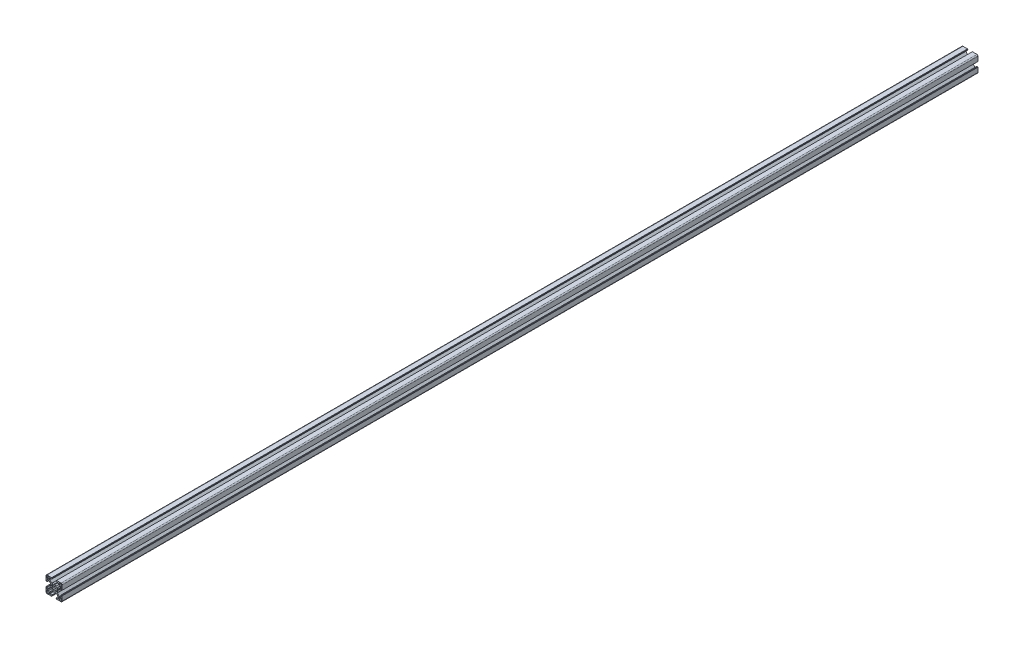
from build123d import *

# Parameters (mm, degrees)
BOSS_EXTRUDE1_DEPTH = 850
CIRPATTERN1_COUNT   = 4


with BuildPart() as part:
    # Sketch3 → Boss-Extrude1 (new, symmetric)
    with BuildSketch(Plane.XY):
        with BuildLine():
            Line((-4.503841895, 3.156803476), (-3.14772708, 1.530298739))
            ThreePointArc((-3.14772708, 1.530298739), (-3.410794979, 0.785160882), (-3.5, 0))
            Line((-3.5, 0), (-5.5, 0))
            Line((-5.5, 0), (-6, 0.866025404))
            Line((-6, 0.866025404), (-6, 3.996841995))
            ThreePointArc((-6, 3.996841995), (-6.038060234, 4.188183711), (-6.146446609, 4.350395385))
            Line((-6.146446609, 4.350395385), (-9.917104615, 8.121053391))
            ThreePointArc((-9.917104615, 8.121053391), (-10.079316289, 8.229439766), (-10.270658005, 8.2675))
            Line((-10.270658005, 8.2675), (-12.29, 8.2675))
            ThreePointArc((-12.29, 8.2675), (-12.643553391, 8.121053391), (-12.79, 7.7675))
            Line((-12.79, 7.7675), (-12.79, 4.5))
            ThreePointArc((-12.79, 4.5), (-12.936446609, 4.146446609), (-13.29, 4))
            Line((-13.29, 4), (-14.5, 4))
            Line((-14.5, 4), (-14.5, 4.5))
            Line((-14.5, 4.5), (-15, 4.5))
            Line((-15, 4.5), (-15, 12.968))
            ThreePointArc((-15, 12.968), (-14.404840979, 14.404840979), (-12.968, 15))
            Line((-12.968, 15), (-4.5, 15))
            Line((-4.5, 15), (-4.5, 14.5))
            Line((-4.5, 14.5), (-4, 14.5))
            Line((-4, 14.5), (-4, 13.29))
            ThreePointArc((-4, 13.29), (-4.146446609, 12.936446609), (-4.5, 12.79))
            Line((-4.5, 12.79), (-7.7675, 12.79))
            ThreePointArc((-7.7675, 12.79), (-8.121053391, 12.643553391), (-8.2675, 12.29))
            Line((-8.2675, 12.29), (-8.2675, 10.270658005))
            ThreePointArc((-8.2675, 10.270658005), (-8.229439766, 10.079316289), (-8.121053391, 9.917104615))
            Line((-8.121053391, 9.917104615), (-4.350395385, 6.146446609))
            ThreePointArc((-4.350395385, 6.146446609), (-4.188183711, 6.038060234), (-3.996841995, 6))
            Line((-3.996841995, 6), (-0.866025404, 6))
            Line((-0.866025404, 6), (0, 5.5))
            Line((0, 5.5), (0, 3.5))
            ThreePointArc((0, 3.5), (-0.785160882, 3.410794979), (-1.530298739, 3.14772708))
            Line((-1.530298739, 3.14772708), (-3.156803476, 4.503841895))
            ThreePointArc((-3.156803476, 4.503841895), (-3.889087297, 3.889087297), (-4.503841895, 3.156803476))
        make_face()
        with BuildLine():
            Line((-12.705, 9.5135), (-10.5135, 9.5135))
            ThreePointArc((-10.5135, 9.5135), (-9.806393219, 9.806393219), (-9.5135, 10.5135))
            Line((-9.5135, 10.5135), (-9.5135, 12.705))
            ThreePointArc((-9.5135, 12.705), (-9.806393219, 13.412106781), (-10.5135, 13.705))
            Line((-10.5135, 13.705), (-12.705, 13.705))
            ThreePointArc((-12.705, 13.705), (-13.412106781, 13.412106781), (-13.705, 12.705))
            Line((-13.705, 12.705), (-13.705, 10.5135))
            ThreePointArc((-13.705, 10.5135), (-13.412106781, 9.806393219), (-12.705, 9.5135))
        make_face(mode=Mode.SUBTRACT)
    boss_extrude1 = extrude(amount=BOSS_EXTRUDE1_DEPTH, both=True)

    # CirPattern1: Boss-Extrude1 ×4 about axis
    cirpattern1_axis = Axis((0, 0, 0), (0, 0, 1))
    for i in range(1, CIRPATTERN1_COUNT):
        add(boss_extrude1.rotate(cirpattern1_axis, i * 360 / CIRPATTERN1_COUNT))


solid = part.part
